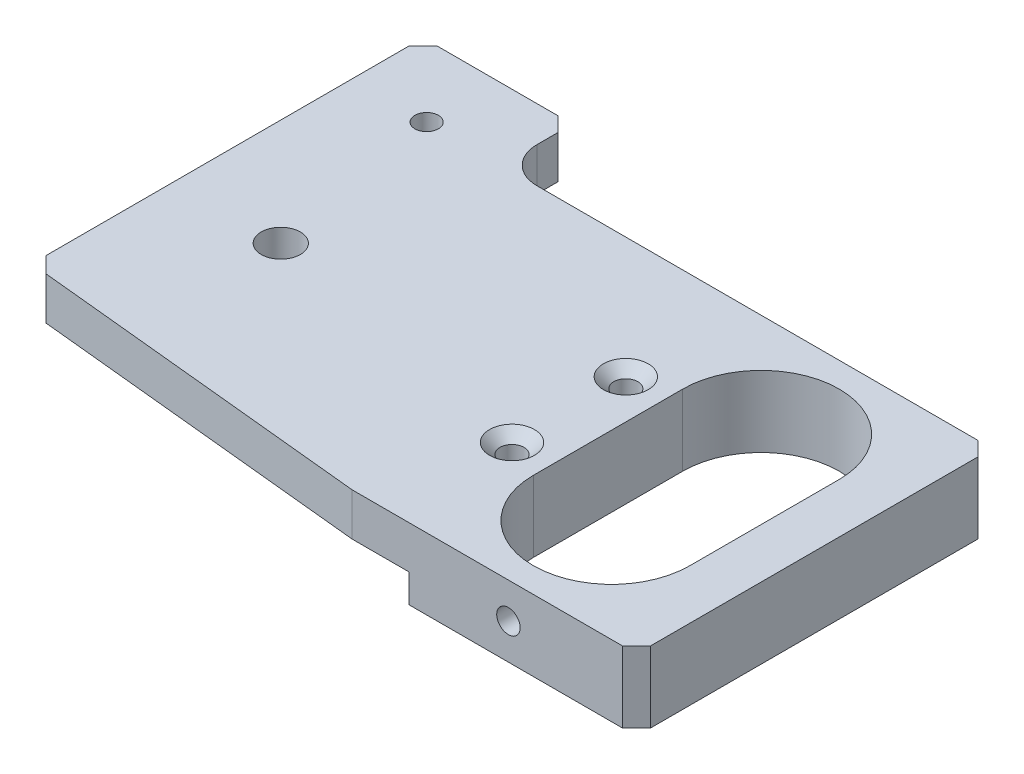
from build123d import *
from OCP.BRepFilletAPI import BRepFilletAPI_MakeChamfer

# Parameters (mm, degrees)
AUFSATZ_LINEAR_AUSTRAGEN1_DEPTH                      = 6
SKIZZE8_W                                            = 32
SKIZZE8_H                                            = 50
AUFSATZ_LINEAR_AUSTRAGEN2_DEPTH                      = 4
SCHNITT_LINEAR_AUSTRAGEN1_DEPTH                      = 62.846584384
STIRNSENKUNG_F_R_M5_FLACHKOPFSCHRAUBE_MI_D           = 5.5
STIRNSENKUNG_F_R_M5_FLACHKOPFSCHRAUBE_MI_DEPTH       = 20
STIRNSENKUNG_F_R_M5_FLACHKOPFSCHRAUBE_MI_CBORE_D     = 11
STIRNSENKUNG_F_R_M5_FLACHKOPFSCHRAUBE_MI_CBORE_DEPTH = 1.7
STIRNSENKUNG_F_R_M5_FLACHKOPFSCHRAUBE_MI_TIP         = 1.652366702
FORMSENKUNG_F_R_M3_LINSENSENKSCHRAUBE_MI_D           = 3.4
FORMSENKUNG_F_R_M3_LINSENSENKSCHRAUBE_MI_DEPTH       = 8.5
FORMSENKUNG_F_R_M3_LINSENSENKSCHRAUBE_MI_CSINK_D     = 6.3
FORMSENKUNG_F_R_M3_LINSENSENKSCHRAUBE_MI_CSINK_ANGLE = 90
FORMSENKUNG_F_R_M3_LINSENSENKSCHRAUBE_MI_TIP         = 1.021463052
FASE1_SIZE                                           = 2
FASE1_SIZE2                                          = 2.233305694
VERRUNDUNG1_R                                        = 5
M4_GEWINDEBOHRUNG1_D                                 = 3.3
M4_GEWINDEBOHRUNG2_REACH                             = 80.333
M4_GEWINDEBOHRUNG2_BORE_R                            = 1.65


with BuildPart() as part:
    # Skizze1 → Aufsatz-Linear austragen1 (new body)
    with BuildSketch(Plane(origin=(0, 0, 0), x_dir=(1, 0, 0), z_dir=(0, 1, 0))):
        Polygon((-50, 35), (-29, 35), (-29, 25), (40, 25), (40, -25), (0, -25), (-50, -20), align=None)
    extrude(amount=AUFSATZ_LINEAR_AUSTRAGEN1_DEPTH)

    # Skizze8 → Aufsatz-Linear austragen2 (add)
    with BuildSketch(Plane.XZ):
        with Locations((24, 0)):
            Rectangle(SKIZZE8_W, SKIZZE8_H)
    extrude(amount=AUFSATZ_LINEAR_AUSTRAGEN2_DEPTH)

    # Skizze4 → Schnitt-Linear austragen1 (cut, through all)
    with BuildSketch(Plane(origin=(0, 6, 0), x_dir=(1, 0, 0), z_dir=(0, 1, 0))):
        with BuildLine():
            Line((11, 10.5), (11, -10.5))
            ThreePointArc((11, -10.5), (22, -21.5), (33, -10.5))
            Line((33, -10.5), (33, 10.5))
            ThreePointArc((33, 10.5), (22, 21.5), (11, 10.5))
        make_face()
    extrude(amount=-SCHNITT_LINEAR_AUSTRAGEN1_DEPTH, mode=Mode.SUBTRACT)

    # Stirnsenkung für M5 Flachkopfschraube mit Schlitz2
    with Locations(Plane(origin=(0, 0, 0), x_dir=(-1, 0, 0), z_dir=(0, -1, 0))):
        with Locations((35, 0)):
            CounterBoreHole(STIRNSENKUNG_F_R_M5_FLACHKOPFSCHRAUBE_MI_D / 2, STIRNSENKUNG_F_R_M5_FLACHKOPFSCHRAUBE_MI_CBORE_D / 2, STIRNSENKUNG_F_R_M5_FLACHKOPFSCHRAUBE_MI_CBORE_DEPTH, depth=STIRNSENKUNG_F_R_M5_FLACHKOPFSCHRAUBE_MI_DEPTH)
            with Locations((0, 0, -(STIRNSENKUNG_F_R_M5_FLACHKOPFSCHRAUBE_MI_DEPTH + STIRNSENKUNG_F_R_M5_FLACHKOPFSCHRAUBE_MI_TIP / 2))):  # 118° drill point
                Cone(0, STIRNSENKUNG_F_R_M5_FLACHKOPFSCHRAUBE_MI_D / 2, STIRNSENKUNG_F_R_M5_FLACHKOPFSCHRAUBE_MI_TIP, mode=Mode.SUBTRACT)

    # Formsenkung für M3 Linsensenkschraube mit Schlitz1
    with Locations(Plane(origin=(0, 6, 0), x_dir=(1, 0, 0), z_dir=(0, 1, 0))):
        with Locations((5.5, 8), (5.5, -8)):
            CounterSinkHole(FORMSENKUNG_F_R_M3_LINSENSENKSCHRAUBE_MI_D / 2, FORMSENKUNG_F_R_M3_LINSENSENKSCHRAUBE_MI_CSINK_D / 2, depth=FORMSENKUNG_F_R_M3_LINSENSENKSCHRAUBE_MI_DEPTH, counter_sink_angle=FORMSENKUNG_F_R_M3_LINSENSENKSCHRAUBE_MI_CSINK_ANGLE)
            with Locations((0, 0, -(FORMSENKUNG_F_R_M3_LINSENSENKSCHRAUBE_MI_DEPTH + FORMSENKUNG_F_R_M3_LINSENSENKSCHRAUBE_MI_TIP / 2))):  # 118° drill point
                Cone(0, FORMSENKUNG_F_R_M3_LINSENSENKSCHRAUBE_MI_D / 2, FORMSENKUNG_F_R_M3_LINSENSENKSCHRAUBE_MI_TIP, mode=Mode.SUBTRACT)

    # Fase1: one chamfer whose edges measure the first distance from different faces: ONE call of the kernel's chamfer builder (chamfer() names one face for all edges)
    fase1_edges_1 = [part.edges().sort_by_distance(p)[0] for p in [
        (40, 1, 25),
        (-50, 3, -35),
        (-29, 3, -35),
        (40, 1, -25),
    ]]
    fase1_edges_2 = [part.edges().sort_by_distance(p)[0] for p in [
        (-50, 3, 20),
    ]]
    fase1_side_2 = [part.faces().sort_by_distance(p)[0] for p in [
        (-50, 3, -7.5),
    ]]
    fase1 = BRepFilletAPI_MakeChamfer(part.part.solid().wrapped)
    for e in fase1_edges_1:
        fase1.Add(FASE1_SIZE, e.wrapped)
    for e in fase1_edges_2:
        fase1.Add(FASE1_SIZE, FASE1_SIZE2, e.wrapped, fase1_side_2[0].wrapped)  # the first distance lies on this face
    add(Compound.cast(fase1.Shape()), mode=Mode.REPLACE)

    # Verrundung1
    verrundung1_edges = [part.edges().sort_by_distance(p)[0] for p in [
        (-29, 3, -25),
    ]]
    fillet(verrundung1_edges, radius=VERRUNDUNG1_R)

    # M4 Gewindebohrung1 (through all)
    with Locations(Plane(origin=(0, 6, 0), x_dir=(1, 0, 0), z_dir=(0, 1, 0))):
        with Locations((-39.5, 25)):
            Hole(M4_GEWINDEBOHRUNG1_D / 2)

    # M4 Gewindebohrung2 bore → M4 Gewindebohrung2 (cut, up to next)
    with BuildSketch(Plane.XY.offset(25), mode=Mode.PRIVATE) as m4_gewindebohrung2_sk1:
        with Locations((22, 1)):
            Circle(M4_GEWINDEBOHRUNG2_BORE_R)
    m4_gewindebohrung2_tool1 = extrude(m4_gewindebohrung2_sk1.sketch, amount=-M4_GEWINDEBOHRUNG2_REACH, mode=Mode.PRIVATE) & part.part
    add(m4_gewindebohrung2_tool1.solids().sort_by_distance((22, 1, 25))[0], mode=Mode.SUBTRACT)


solid = part.part
